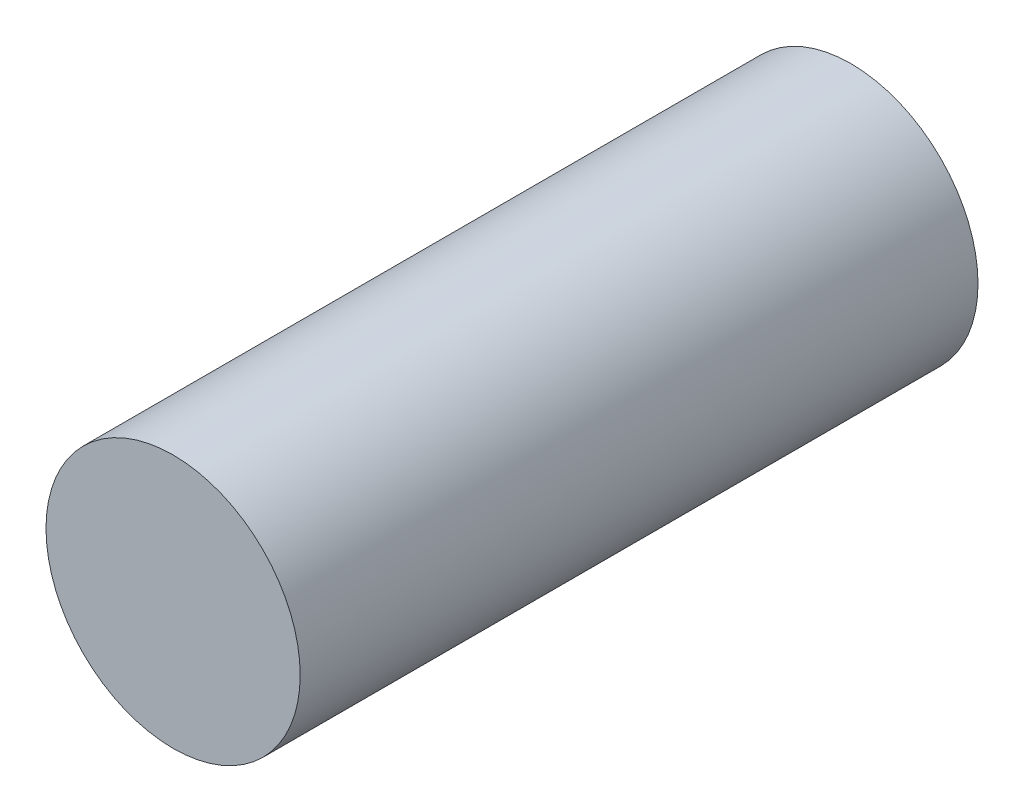
from build123d import *

# Parameters (mm, degrees)
SKETCH2_R           = 2.38125
BOSS_EXTRUDE1_DEPTH = 6.35


with BuildPart() as part:
    # Sketch2 → Boss-Extrude1 (new, symmetric)
    with BuildSketch(Plane.XY):
        with Locations(Location((0, 0, 0), (0, 0, 180))):
            Circle(SKETCH2_R)
    extrude(amount=BOSS_EXTRUDE1_DEPTH, both=True)


solid = part.part
